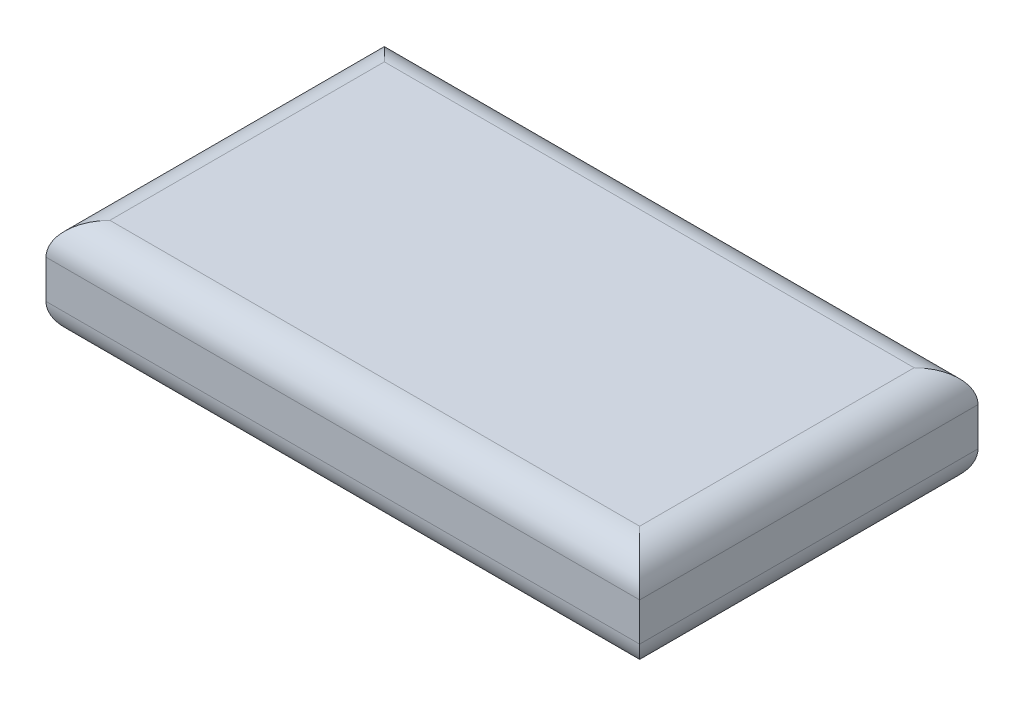
from build123d import *

# Parameters (mm, degrees)
SKETCH1_W           = 46.5
SKETCH1_H           = 26.5
BOSS_EXTRUDE1_DEPTH = 8
FILLET1_R           = 2.5


with BuildPart() as part:
    # Sketch1 → Boss-Extrude1 (new body)
    with BuildSketch(Plane(origin=(0, 0, 0), x_dir=(1, 0, 0), z_dir=(0, 1, 0))):
        Rectangle(SKETCH1_W, SKETCH1_H)
    extrude(amount=BOSS_EXTRUDE1_DEPTH)

    # Fillet1
    fillet1_edges = [part.edges().sort_by_distance(p)[0] for p in [
        (-23.25, 8, 0),
        (0, 8, 13.25),
        (23.25, 8, 0),
        (0, 0, 13.25),
        (-23.25, 0, 0),
        (0, 0, -13.25),
        (23.25, 0, 0),
        (0, 8, -13.25),
    ]]
    fillet(fillet1_edges, radius=FILLET1_R)


solid = part.part
